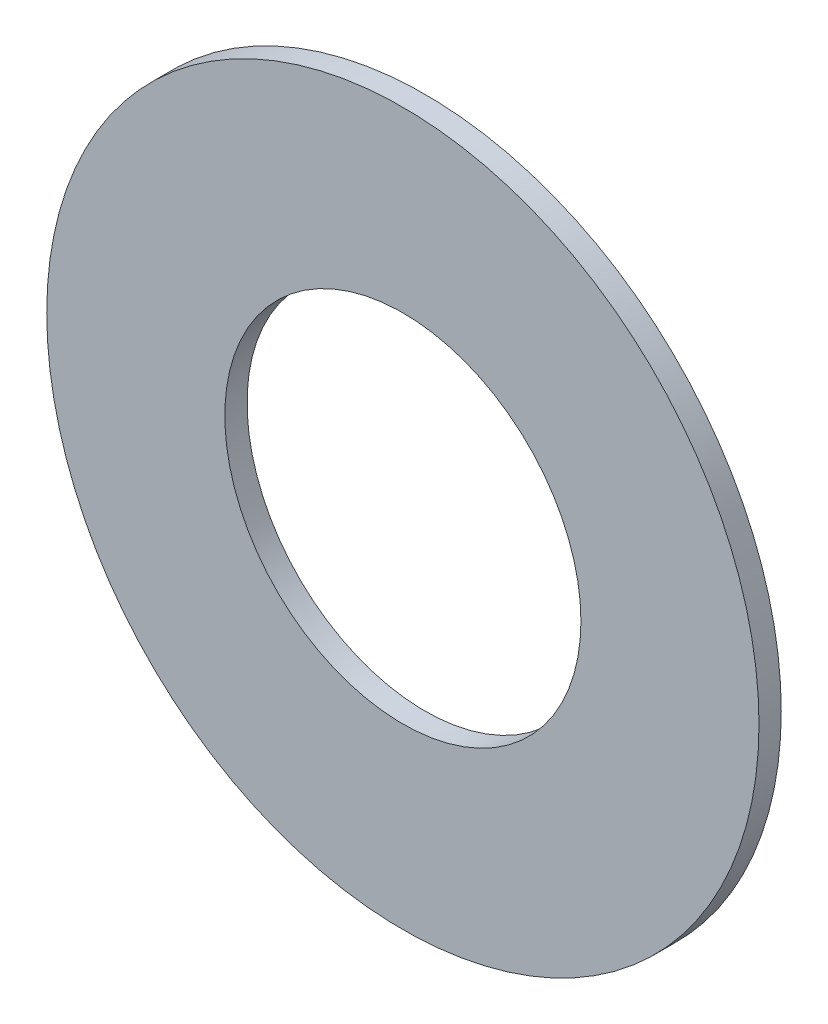
from build123d import *

# Parameters (mm, degrees)
SKETCH1_R           = 8
SKETCH1_R_2         = 4
BOSS_EXTRUDE1_DEPTH = 0.5


with BuildPart() as part:
    # Sketch1 → Boss-Extrude1 (new body)
    with BuildSketch(Plane.XY):
        Circle(SKETCH1_R)
        Circle(SKETCH1_R_2, mode=Mode.SUBTRACT)
    extrude(amount=BOSS_EXTRUDE1_DEPTH)


solid = part.part
